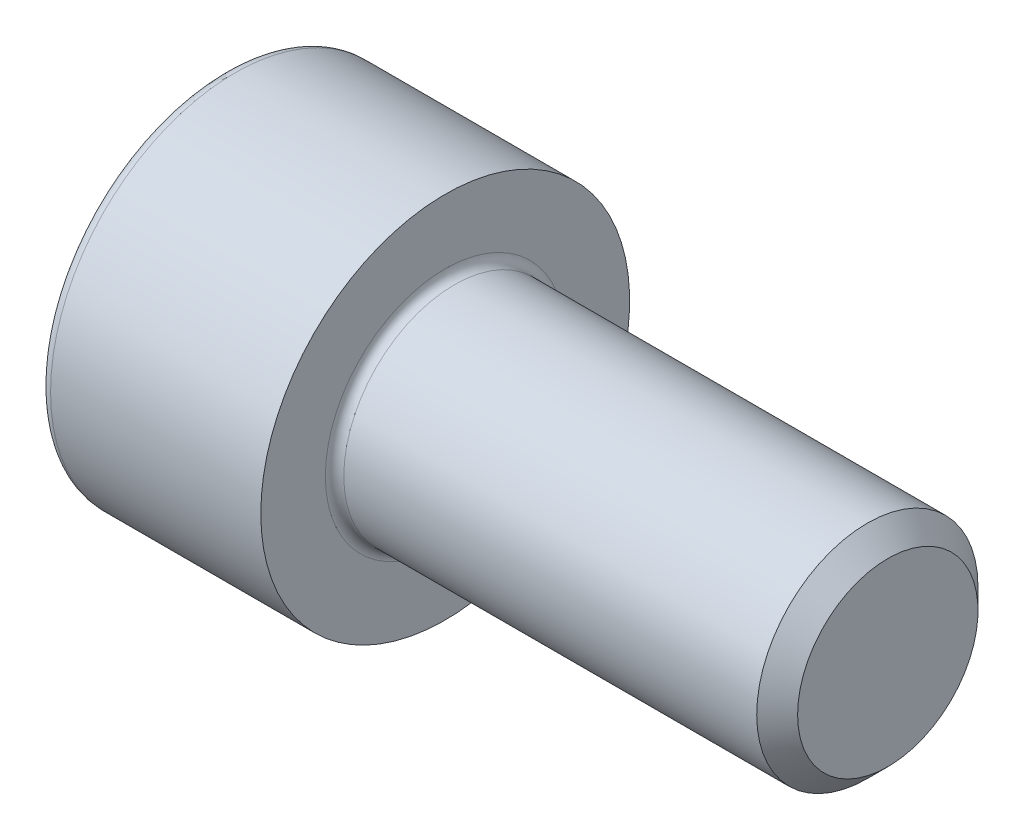
from build123d import *

# Parameters (mm, degrees)
FILLET1_R   = 0.25
FILLET2_R   = 0.3
HEX_2_DEPTH = 3


with BuildPart() as part:
    # BodySke → BaseBody (revolve)
    with BuildSketch(Plane.XY, mode=Mode.PRIVATE) as basebody_sk:
        Polygon((0, 0), (0, 5), (6, 5), (6, 3), (17.4455, 3), (18, 2.4455), (18, 0), align=None)
    revolve(basebody_sk.sketch.rotate(Axis((0, 0, 0), (1, 0, 0)), 90), axis=Axis((0, 0, 0), (1, 0, 0)))

    # Fillet1
    fillet1_edges = [part.edges().sort_by_distance(p)[0] for p in [
        (6, 0, -3),
    ]]
    fillet(fillet1_edges, radius=FILLET1_R)

    # Fillet2
    fillet2_edges = [part.edges().sort_by_distance(p)[0] for p in [
        (0, 0, -5),
    ]]
    fillet(fillet2_edges, radius=FILLET2_R)

    # HexSke → Hex 2 (cut)
    with BuildSketch(Plane(origin=(0, 0, 0), x_dir=(0, 0, -1), z_dir=(1, 0, 0))):
        Polygon((0, 2.886751346), (-2.5, 1.443375673), (-2.5, -1.443375673), (0, -2.886751346), (2.5, -1.443375673), (2.5, 1.443375673), align=None)
    extrude(amount=HEX_2_DEPTH, mode=Mode.SUBTRACT)

    # Hex-PreBroachSke → Hex-PreBroach (revolve, cut)
    with BuildSketch(Plane.XY, mode=Mode.PRIVATE) as hex_prebroach_sk:
        Polygon((0, 0), (0, 2.5), (3, 2.5), (4.443375673, 0), align=None)
    revolve(hex_prebroach_sk.sketch.rotate(Axis((0, 0, 0), (1, 0, 0)), 270), axis=Axis((0, 0, 0), (1, 0, 0)), mode=Mode.SUBTRACT)


solid = part.part
